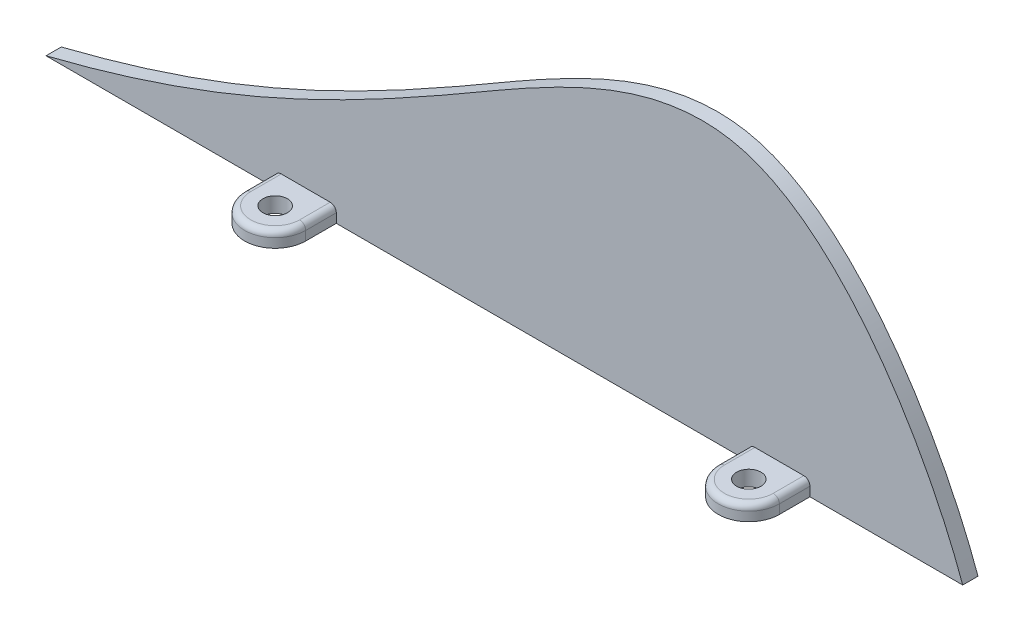
from build123d import *

# Parameters (mm, degrees)
EXTRUDE_2_DEPTH               = 2
SKETCH_2_W                    = 8
SKETCH_2_H                    = 2
EXTRUDE_3_DEPTH               = 8
HOLE_WIZARD_M3_1_D            = 3.2
FILLET_1_RADIUS               = 4
FILLET_1_LENGTH               = 2
FILLET_2_RADIUS               = 4
FILLET_2_LENGTH               = 2
FILLET_1_OF_MIRROR_2_2_RADIUS = 4
FILLET_1_OF_MIRROR_2_2_LENGTH = 2
FILLET_2_OF_MIRROR_2_2_RADIUS = 4
FILLET_2_OF_MIRROR_2_2_LENGTH = 2
FILLET_3_R                    = 0.8


with BuildPart() as part:
    # 草图1 → 凸台-拉伸2 (new body)
    with BuildSketch(Plane.XY):
        with BuildLine():
            Line((30.94908553, 17.5), (20.331961555, 17.5))
            add(Edge.make_bspline(
                [(-60, -17.5), (-39.159956845, -12.29338405), (-17.237163247, -2.064497368), (11.506670309, 15.639718908), (20.331961555, 17.5)],
                knots=[0, 0, 0, 0, 0.404702993, 0.59801928, 0.59801928, 0.59801928, 0.59801928], degree=3))
            Line((-60, -17.5), (60, -17.5))
            add(Edge.make_bspline(
                [(30.94908553, 17.5), (44.676235266, 13.960045899), (55.755627624, -5.631181905), (60, -17.5)],
                knots=[0.677892973, 0.677892973, 0.677892973, 0.677892973, 1, 1, 1, 1], degree=3))
        make_face()
        with BuildLine():
            add(Edge.make_bspline(
                [(20.331961555, 17.5), (23.978362008, 18.268623905), (27.545129563, 18.377811353), (30.94908553, 17.5)],
                knots=[0.59801928, 0.59801928, 0.59801928, 0.59801928, 0.677892973, 0.677892973, 0.677892973, 0.677892973], degree=3))
            Line((20.331961555, 17.5), (30.94908553, 17.5))
        make_face()
    extrude(amount=EXTRUDE_2_DEPTH)

    # 草图2 → 凸台-拉伸3 (add)
    with BuildSketch(Plane.XY.offset(2)):
        with Locations((36, -16.5)):
            Rectangle(SKETCH_2_W, SKETCH_2_H)
        with Locations((-26, -16.5)):
            Rectangle(SKETCH_2_W, SKETCH_2_H)
    extrude_3 = extrude(amount=EXTRUDE_3_DEPTH)

    # M3 间隙孔1 (through all)
    with Locations(Plane(origin=(0, -15.5, 0), x_dir=(1, 0, 0), z_dir=(0, 1, 0))):
        with Locations((-26, -6), (36, -6)):
            hole_wizard_m3_1 = Hole(HOLE_WIZARD_M3_1_D / 2)

    # 圆角1: full round fillet: the end face becomes a half cylinder, R = half its width
    fillet_1_face = Plane((-26, -16.5, 10), x_dir=(0, 1, 0), z_dir=(0, 0, 1))  # on the end face: x along it, z out of the body
    fillet_1_slab = fillet_1_face.offset(-FILLET_1_RADIUS / 2) * Box(FILLET_1_LENGTH, 2 * FILLET_1_RADIUS, FILLET_1_RADIUS, mode=Mode.PRIVATE)  # the body's end, R deep
    fillet_1_round = Plane((-26, -16.5, 6), x_dir=(0, 0, 1), z_dir=(0, 1, 0)) * Cylinder(FILLET_1_RADIUS, FILLET_1_LENGTH, mode=Mode.PRIVATE)  # its axis R under the face
    add(fillet_1_slab - fillet_1_round, mode=Mode.SUBTRACT)

    # 圆角2: full round fillet: the end face becomes a half cylinder, R = half its width
    fillet_2_face = Plane((36, -16.5, 10), x_dir=(0, 1, 0), z_dir=(0, 0, 1))  # on the end face: x along it, z out of the body
    fillet_2_slab = fillet_2_face.offset(-FILLET_2_RADIUS / 2) * Box(FILLET_2_LENGTH, 2 * FILLET_2_RADIUS, FILLET_2_RADIUS, mode=Mode.PRIVATE)  # the body's end, R deep
    fillet_2_round = Plane((36, -16.5, 6), x_dir=(0, 0, 1), z_dir=(0, 1, 0)) * Cylinder(FILLET_2_RADIUS, FILLET_2_LENGTH, mode=Mode.PRIVATE)  # its axis R under the face
    add(fillet_2_slab - fillet_2_round, mode=Mode.SUBTRACT)

    # 镜向2: 凸台-拉伸3, M3 间隙孔1 across plane
    add(extrude_3.mirror(Plane.XY.offset(1)))
    add(hole_wizard_m3_1.mirror(Plane.XY.offset(1)), mode=Mode.SUBTRACT)

    # 圆角1 of Mirror 2 2: full round fillet: the end face becomes a half cylinder, R = half its width
    fillet_1_of_mirror_2_2_face = Plane((-26, -16.5, -8), x_dir=(0, 1, 0), z_dir=(0, 0, -1))  # on the end face: x along it, z out of the body
    fillet_1_of_mirror_2_2_slab = fillet_1_of_mirror_2_2_face.offset(-FILLET_1_OF_MIRROR_2_2_RADIUS / 2) * Box(FILLET_1_OF_MIRROR_2_2_LENGTH, 2 * FILLET_1_OF_MIRROR_2_2_RADIUS, FILLET_1_OF_MIRROR_2_2_RADIUS, mode=Mode.PRIVATE)  # the body's end, R deep
    fillet_1_of_mirror_2_2_round = Plane((-26, -16.5, -4), x_dir=(0, 0, -1), z_dir=(0, 1, 0)) * Cylinder(FILLET_1_OF_MIRROR_2_2_RADIUS, FILLET_1_OF_MIRROR_2_2_LENGTH, mode=Mode.PRIVATE)  # its axis R under the face
    add(fillet_1_of_mirror_2_2_slab - fillet_1_of_mirror_2_2_round, mode=Mode.SUBTRACT)

    # 圆角2 of Mirror 2 2: full round fillet: the end face becomes a half cylinder, R = half its width
    fillet_2_of_mirror_2_2_face = Plane((36, -16.5, -8), x_dir=(0, 1, 0), z_dir=(0, 0, -1))  # on the end face: x along it, z out of the body
    fillet_2_of_mirror_2_2_slab = fillet_2_of_mirror_2_2_face.offset(-FILLET_2_OF_MIRROR_2_2_RADIUS / 2) * Box(FILLET_2_OF_MIRROR_2_2_LENGTH, 2 * FILLET_2_OF_MIRROR_2_2_RADIUS, FILLET_2_OF_MIRROR_2_2_RADIUS, mode=Mode.PRIVATE)  # the body's end, R deep
    fillet_2_of_mirror_2_2_round = Plane((36, -16.5, -4), x_dir=(0, 0, -1), z_dir=(0, 1, 0)) * Cylinder(FILLET_2_OF_MIRROR_2_2_RADIUS, FILLET_2_OF_MIRROR_2_2_LENGTH, mode=Mode.PRIVATE)  # its axis R under the face
    add(fillet_2_of_mirror_2_2_slab - fillet_2_of_mirror_2_2_round, mode=Mode.SUBTRACT)

    # 圆角3
    fillet_3_edges = [part.edges().sort_by_distance(p)[0] for p in [
        (32, -15.5, -2),
        (40, -15.5, -2),
        (36, -15.5, -8),
        (-30, -15.5, 4),
        (-22, -15.5, 4),
        (-26, -15.5, 10),
        (32, -15.5, 4),
        (40, -15.5, 4),
        (36, -15.5, 10),
        (-30, -15.5, -2),
        (-22, -15.5, -2),
        (-26, -15.5, -8),
    ]]
    fillet(fillet_3_edges, radius=FILLET_3_R)


solid = part.part
